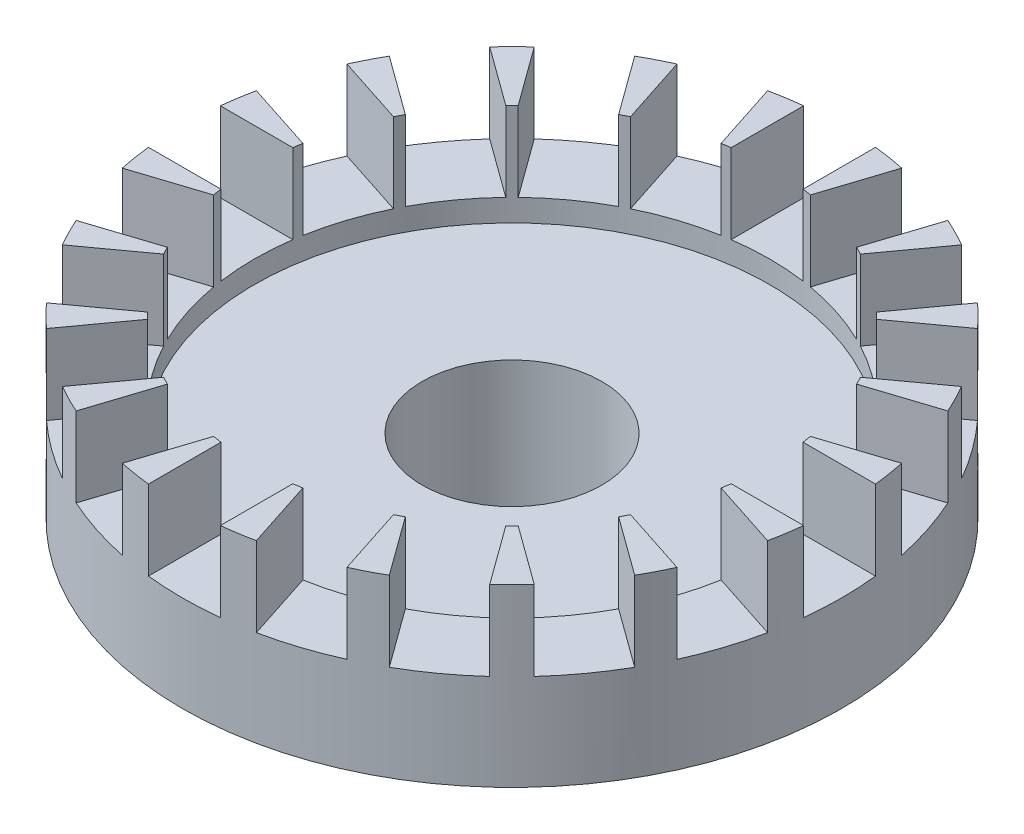
from build123d import *

# Parameters (mm, degrees)
SKETCH_4_R               = 5.5
SKETCH_4_R_2             = 1.5
EXTRUDE_1_DEPTH          = 2.93
EXTRUDE_START            = 2
SKETCH_5_R               = 2.5
SKETCH_5_R_2             = 1.5
EXTRUDE_2_DEPTH          = 2
SKETCH_6_R               = 4.3
CUT_EXTRUDE_1_DEPTH      = 1.7
SKETCH_7_W               = 1.2
SKETCH_7_H               = 1.242066229
CUT_EXTRUDE_2_DEPTH      = 1.33
PATTERN_CIRCULAR_1_COUNT = 20


with BuildPart() as part:
    # 草图4 → 凸台-拉伸1 (new body)
    with BuildSketch(Plane(origin=(0, 0, 0), x_dir=(1, 0, 0), z_dir=(0, 1, 0))):
        with Locations(Location((0, 0, 0), (0, 0, 90))):
            Circle(SKETCH_4_R)
        with Locations(Location((0, 0, 0), (0, 0, 90))):
            Circle(SKETCH_4_R_2, mode=Mode.SUBTRACT)
    extrude(amount=EXTRUDE_1_DEPTH)

    # 草图5 → 凸台-拉伸2 (add)
    with BuildSketch(Plane.XZ.offset(EXTRUDE_START)):
        with Locations(Location((0, 0, 0), (0, 0, 90))):
            Circle(SKETCH_5_R)
        with Locations(Location((0, 0, 0), (0, 0, 270))):
            Circle(SKETCH_5_R_2, mode=Mode.SUBTRACT)
    extrude(amount=-EXTRUDE_2_DEPTH)

    # 草图6 → 切除-拉伸1 (cut)
    with BuildSketch(Plane(origin=(0, 2.93, 0), x_dir=(1, 0, 0), z_dir=(0, 1, 0))):
        with Locations(Location((0, 0, 0), (0, 0, 270))):
            Circle(SKETCH_6_R)
    extrude(amount=-CUT_EXTRUDE_1_DEPTH, mode=Mode.SUBTRACT)

    # 草图7 → 切除-拉伸2 (cut)
    with BuildSketch(Plane(origin=(0, 2.93, 0), x_dir=(1, 0, 0), z_dir=(0, 1, 0))):
        with Locations((0, 4.878966886)):
            Rectangle(SKETCH_7_W, SKETCH_7_H)
    cut_extrude_2 = extrude(amount=-CUT_EXTRUDE_2_DEPTH, mode=Mode.SUBTRACT)

    # 阵列(圆周)1: 切除-拉伸2 ×20 about axis
    pattern_circular_1_axis = Axis((0, 0, 0), (0, 1, 0))
    for i in range(1, PATTERN_CIRCULAR_1_COUNT):
        add(cut_extrude_2.rotate(pattern_circular_1_axis, i * 360 / PATTERN_CIRCULAR_1_COUNT), mode=Mode.SUBTRACT)


solid = part.part
